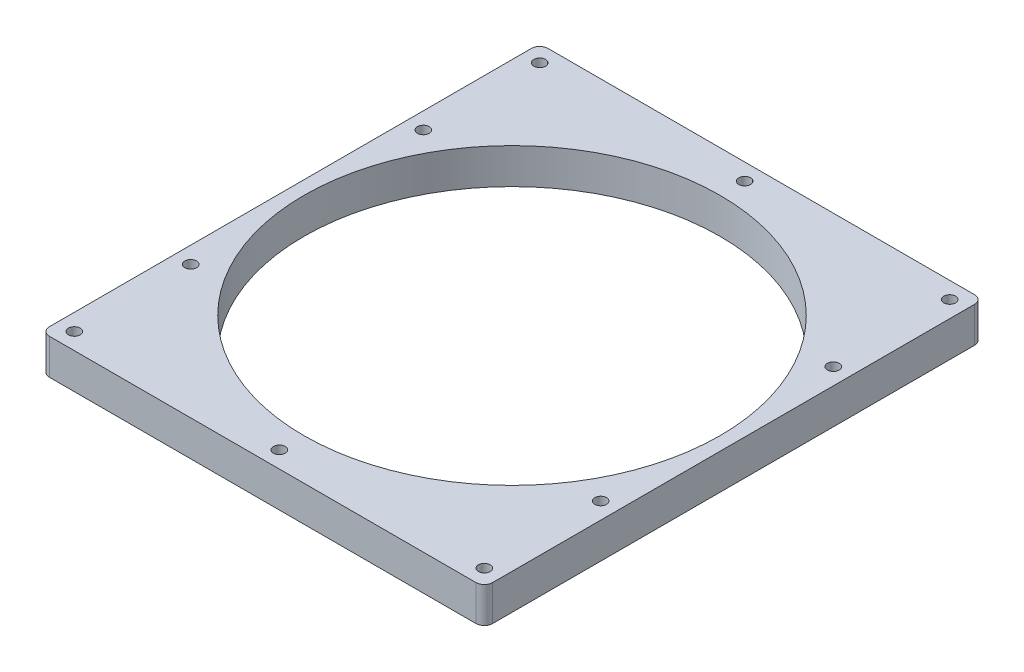
from build123d import *

# Parameters (mm, degrees)
SKETCH1_W           = 160
SKETCH1_H           = 180
SKETCH1_R           = 75.125
SKETCH1_R_2         = 2.125
BOSS_EXTRUDE1_DEPTH = 12.825
FILLET1_R           = 3


with BuildPart() as part:
    # Sketch1 → Boss-Extrude1 (new body)
    with BuildSketch(Plane(origin=(0, 0, 0), x_dir=(1, 0, 0), z_dir=(0, 1, 0))):
        Rectangle(SKETCH1_W, SKETCH1_H)
        with Locations(Location((0, 0, 0), (0, 0, 270))):
            Circle(SKETCH1_R, mode=Mode.SUBTRACT)
        with Locations(Location((-74, -84, 0), (0, 0, 270))):
            Circle(SKETCH1_R_2, mode=Mode.SUBTRACT)
        with Locations(Location((-74, -42, 0), (0, 0, 270))):
            Circle(SKETCH1_R_2, mode=Mode.SUBTRACT)
        with Locations(Location((-74, 84, 0), (0, 0, 90))):
            Circle(SKETCH1_R_2, mode=Mode.SUBTRACT)
        with Locations(Location((74, -84, 0), (0, 0, 90))):
            Circle(SKETCH1_R_2, mode=Mode.SUBTRACT)
        with Locations(Location((74, -42, 0), (0, 0, 90))):
            Circle(SKETCH1_R_2, mode=Mode.SUBTRACT)
        with Locations(Location((74, 84, 0), (0, 0, 270))):
            Circle(SKETCH1_R_2, mode=Mode.SUBTRACT)
        with Locations(Location((0, -84, 0), (0, 0, 270))):
            Circle(SKETCH1_R_2, mode=Mode.SUBTRACT)
        with Locations(Location((0, 84, 0), (0, 0, 90))):
            Circle(SKETCH1_R_2, mode=Mode.SUBTRACT)
        with Locations(Location((74, 42, 0), (0, 0, 270))):
            Circle(SKETCH1_R_2, mode=Mode.SUBTRACT)
        with Locations(Location((-74, 42, 0), (0, 0, 90))):
            Circle(SKETCH1_R_2, mode=Mode.SUBTRACT)
    extrude(amount=BOSS_EXTRUDE1_DEPTH)

    # Fillet1
    fillet1_edges = [part.edges().sort_by_distance(p)[0] for p in [
        (80, 6.4125, 90),
        (-80, 6.4125, 90),
        (-80, 6.4125, -90),
        (80, 6.4125, -90),
    ]]
    fillet(fillet1_edges, radius=FILLET1_R)


solid = part.part
